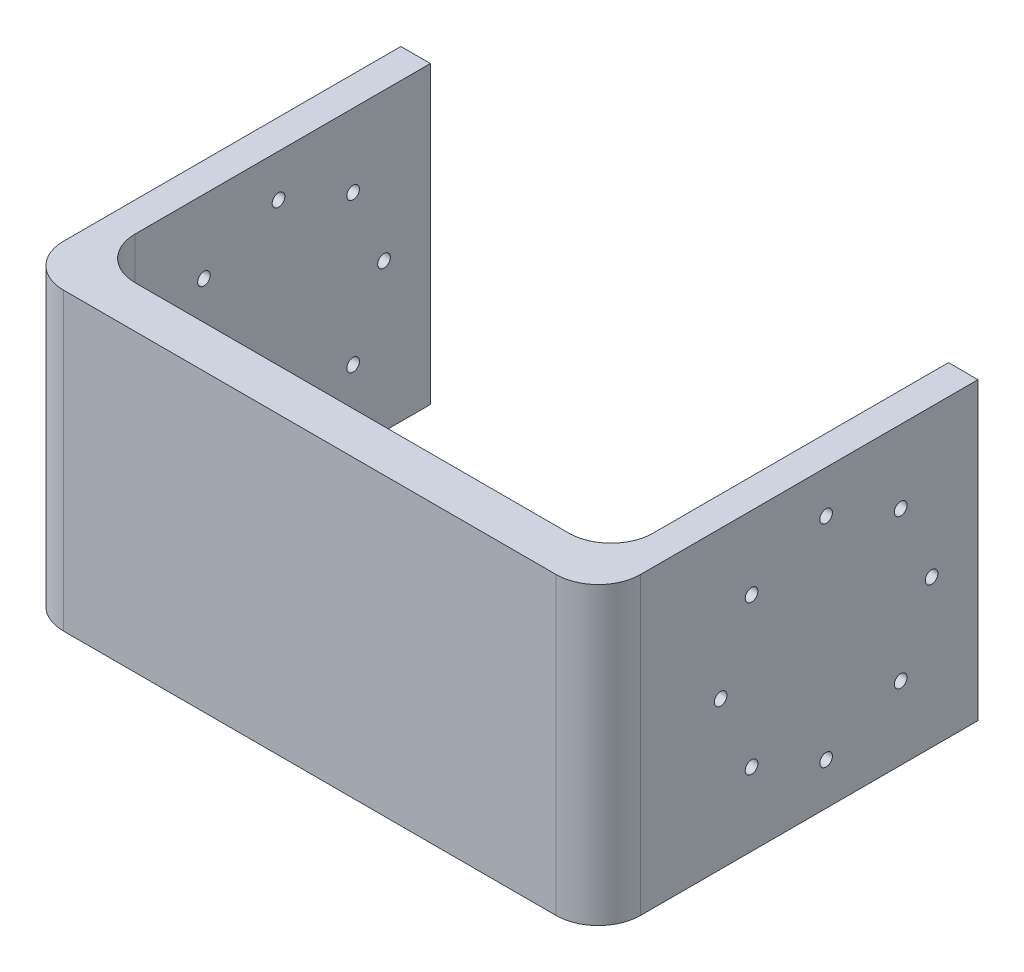
from build123d import *

# Parameters (mm, degrees)
BOSS_EXTRUDE1_DEPTH = 17.5
CUT_EXTRUDE1_REACH  = 85.725
SKETCH2_R           = 0.75
SKETCH2_3_R         = 0.75
CUT_EXTRUDE2_DEPTH  = 84.724608091


with BuildPart() as part:
    # Sketch1 → Boss-Extrude1 (new, symmetric)
    with BuildSketch(Plane(origin=(0, 0, 0), x_dir=(1, 0, 0), z_dir=(0, 1, 0))):
        with BuildLine():
            Line((-29.2, 0), (29.2, 0))
            ThreePointArc((29.2, 0), (32.735533906, 1.464466094), (34.2, 5))
            Line((34.2, 5), (34.2, 45))
            Line((34.2, 45), (30.7, 45))
            Line((30.7, 45), (30.7, 10))
            ThreePointArc((30.7, 10), (29.235533906, 6.464466094), (25.7, 5))
            Line((25.7, 5), (-25.7, 5))
            ThreePointArc((-25.7, 5), (-29.235533906, 6.464466094), (-30.7, 10))
            Line((-30.7, 10), (-30.7, 45))
            Line((-30.7, 45), (-34.2, 45))
            Line((-34.2, 45), (-34.2, 5))
            ThreePointArc((-34.2, 5), (-32.735533906, 1.464466094), (-29.2, 0))
        make_face()
    extrude(amount=BOSS_EXTRUDE1_DEPTH, both=True)

    # Cut-Extrude1: up to this face of the body (flat: up to its plane)
    cut_extrude1_end = Plane(part.part.faces().sort_by_distance((34.2, 0, -25))[0])
    # Sketch2 → Cut-Extrude1 (cut, up to the picked face)
    with BuildSketch(Plane.ZY.offset(34.2), mode=Mode.PRIVATE) as cut_extrude1_sk1:
        with Locations((-27, 12.5)):
            Circle(SKETCH2_R)
    cut_extrude1_tool1 = split(extrude(cut_extrude1_sk1.sketch, amount=-CUT_EXTRUDE1_REACH, mode=Mode.PRIVATE), bisect_by=cut_extrude1_end, keep=Keep.BOTH, mode=Mode.PRIVATE)
    # Sketch2 → Cut-Extrude1 (cut, up to the picked face)
    with BuildSketch(Plane.ZY.offset(34.2), mode=Mode.PRIVATE) as cut_extrude1_sk2:
        with Locations((-18.161165235, 8.838834765)):
            Circle(SKETCH2_R)
    cut_extrude1_tool2 = split(extrude(cut_extrude1_sk2.sketch, amount=-CUT_EXTRUDE1_REACH, mode=Mode.PRIVATE), bisect_by=cut_extrude1_end, keep=Keep.BOTH, mode=Mode.PRIVATE)
    # Sketch2 → Cut-Extrude1 (cut, up to the picked face)
    with BuildSketch(Plane.ZY.offset(34.2), mode=Mode.PRIVATE) as cut_extrude1_sk3:
        with Locations((-14.5, 0)):
            Circle(SKETCH2_R)
    cut_extrude1_tool3 = split(extrude(cut_extrude1_sk3.sketch, amount=-CUT_EXTRUDE1_REACH, mode=Mode.PRIVATE), bisect_by=cut_extrude1_end, keep=Keep.BOTH, mode=Mode.PRIVATE)
    # Sketch2 → Cut-Extrude1 (cut, up to the picked face)
    with BuildSketch(Plane.ZY.offset(34.2), mode=Mode.PRIVATE) as cut_extrude1_sk4:
        with Locations((-18.161165235, -8.838834765)):
            Circle(SKETCH2_R)
    cut_extrude1_tool4 = split(extrude(cut_extrude1_sk4.sketch, amount=-CUT_EXTRUDE1_REACH, mode=Mode.PRIVATE), bisect_by=cut_extrude1_end, keep=Keep.BOTH, mode=Mode.PRIVATE)
    # Sketch2 → Cut-Extrude1 (cut, up to the picked face)
    with BuildSketch(Plane.ZY.offset(34.2), mode=Mode.PRIVATE) as cut_extrude1_sk5:
        with Locations((-35.838834765, -8.838834765)):
            Circle(SKETCH2_R)
    cut_extrude1_tool5 = split(extrude(cut_extrude1_sk5.sketch, amount=-CUT_EXTRUDE1_REACH, mode=Mode.PRIVATE), bisect_by=cut_extrude1_end, keep=Keep.BOTH, mode=Mode.PRIVATE)
    # Sketch2 → Cut-Extrude1 (cut, up to the picked face)
    with BuildSketch(Plane.ZY.offset(34.2), mode=Mode.PRIVATE) as cut_extrude1_sk6:
        with Locations((-39.5, 0)):
            Circle(SKETCH2_R)
    cut_extrude1_tool6 = split(extrude(cut_extrude1_sk6.sketch, amount=-CUT_EXTRUDE1_REACH, mode=Mode.PRIVATE), bisect_by=cut_extrude1_end, keep=Keep.BOTH, mode=Mode.PRIVATE)
    # Sketch2 → Cut-Extrude1 (cut, up to the picked face)
    with BuildSketch(Plane.ZY.offset(34.2), mode=Mode.PRIVATE) as cut_extrude1_sk7:
        with Locations((-35.838834765, 8.838834765)):
            Circle(SKETCH2_R)
    cut_extrude1_tool7 = split(extrude(cut_extrude1_sk7.sketch, amount=-CUT_EXTRUDE1_REACH, mode=Mode.PRIVATE), bisect_by=cut_extrude1_end, keep=Keep.BOTH, mode=Mode.PRIVATE)
    add(cut_extrude1_tool1.solids().sort_by(Axis((-34.2, 12.5, -27), (1, 0, 0)))[0], mode=Mode.SUBTRACT)
    add(cut_extrude1_tool2.solids().sort_by(Axis((-34.2, 8.838835, -18.161165), (1, 0, 0)))[0], mode=Mode.SUBTRACT)
    add(cut_extrude1_tool3.solids().sort_by(Axis((-34.2, 0, -14.5), (1, 0, 0)))[0], mode=Mode.SUBTRACT)
    add(cut_extrude1_tool4.solids().sort_by(Axis((-34.2, -8.838835, -18.161165), (1, 0, 0)))[0], mode=Mode.SUBTRACT)
    add(cut_extrude1_tool5.solids().sort_by(Axis((-34.2, -8.838835, -35.838835), (1, 0, 0)))[0], mode=Mode.SUBTRACT)
    add(cut_extrude1_tool6.solids().sort_by(Axis((-34.2, 0, -39.5), (1, 0, 0)))[0], mode=Mode.SUBTRACT)
    add(cut_extrude1_tool7.solids().sort_by(Axis((-34.2, 8.838835, -35.838835), (1, 0, 0)))[0], mode=Mode.SUBTRACT)

    # Sketch2<3> → Cut-Extrude2 (cut, through all)
    with BuildSketch(Plane.ZY.offset(34.2)):
        with Locations((-27, -12.5)):
            Circle(SKETCH2_3_R)
    extrude(amount=-CUT_EXTRUDE2_DEPTH, mode=Mode.SUBTRACT)


solid = part.part
